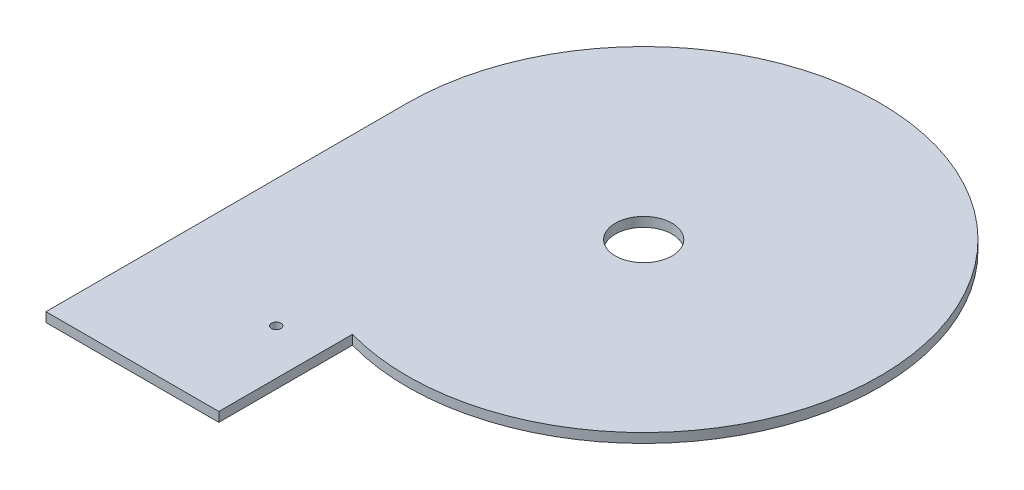
from build123d import *

# Parameters (mm, degrees)
SKETCH1_R           = 50
BOSS_EXTRUDE1_DEPTH = 2
SKETCH2_R           = 6
CUT_EXTRUDE1_DEPTH  = 2
SKETCH3_W           = 36.555538841
SKETCH3_H           = 76.419948839
BOSS_EXTRUDE2_DEPTH = 2
CUT_EXTRUDE2_REACH  = 93.346
SKETCH8_R           = 1


with BuildPart() as part:
    # Sketch1 → Boss-Extrude1 (new body)
    with BuildSketch(Plane(origin=(0, 0, 0), x_dir=(1, 0, 0), z_dir=(0, 1, 0))):
        with Locations(Location((0, 0, 0), (0, 0, 270))):
            Circle(SKETCH1_R)
    extrude(amount=BOSS_EXTRUDE1_DEPTH)

    # Sketch2 → Cut-Extrude1 (cut)
    with BuildSketch(Plane(origin=(0, 2, 0), x_dir=(1, 0, 0), z_dir=(0, 1, 0))):
        with Locations(Location((0, 0, 0), (0, 0, 270))):
            Circle(SKETCH2_R)
    extrude(amount=-CUT_EXTRUDE1_DEPTH, mode=Mode.SUBTRACT)

    # Sketch3 → Boss-Extrude2 (add, through all)
    with BuildSketch(Plane.XZ):
        with Locations((-31.722230579, 38.209974419)):
            Rectangle(SKETCH3_W, SKETCH3_H)
    extrude(amount=-BOSS_EXTRUDE2_DEPTH)

    # Sketch8 → Cut-Extrude2 (cut, up to next)
    with BuildSketch(Plane.XZ, mode=Mode.PRIVATE) as cut_extrude2_sk1:
        with Locations(Location((-23.05, 54.68, 0), (0, 0, 270))):
            Circle(SKETCH8_R)
    cut_extrude2_tool1 = extrude(cut_extrude2_sk1.sketch, amount=-CUT_EXTRUDE2_REACH, mode=Mode.PRIVATE) & part.part
    add(cut_extrude2_tool1.solids().sort_by_distance((-23.05, 0, 54.68))[0], mode=Mode.SUBTRACT)


solid = part.part
